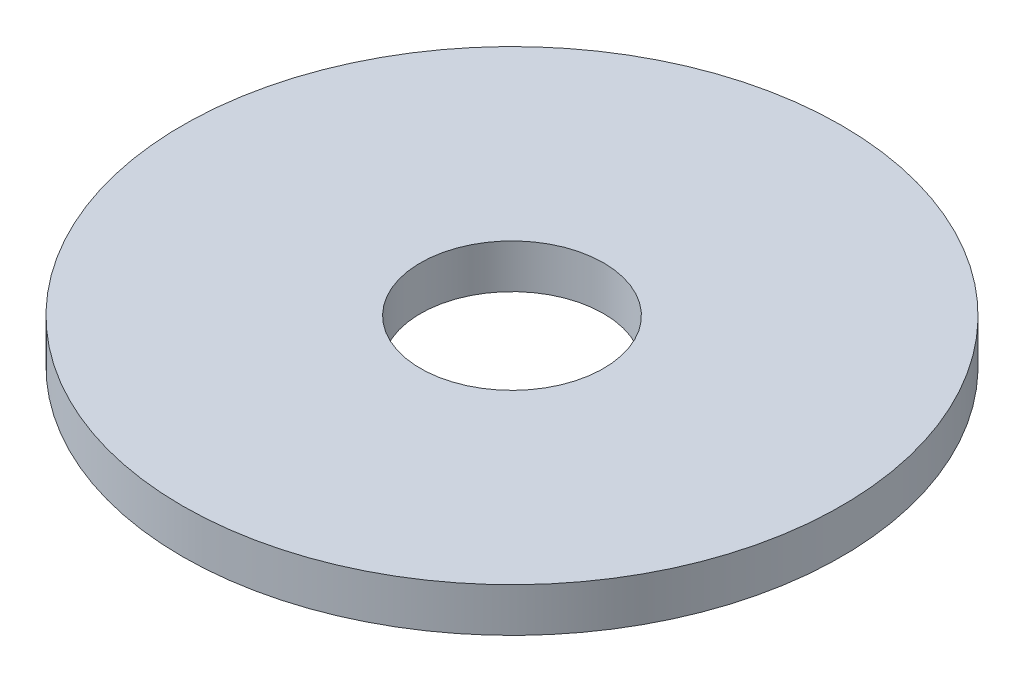
from build123d import *

# Parameters (mm, degrees)
SKETCH1_R           = 7.14375
SKETCH1_R_2         = 1.984375
BOSS_EXTRUDE1_DEPTH = 0.9525


with BuildPart() as part:
    # Sketch1 → Boss-Extrude1 (new body)
    with BuildSketch(Plane(origin=(0, 0, 0), x_dir=(1, 0, 0), z_dir=(0, 1, 0))):
        with Locations(Location((0, 0, 0), (0, 0, 90))):
            Circle(SKETCH1_R)
        with Locations(Location((0, 0, 0), (0, 0, 90))):
            Circle(SKETCH1_R_2, mode=Mode.SUBTRACT)
    extrude(amount=BOSS_EXTRUDE1_DEPTH)


solid = part.part
